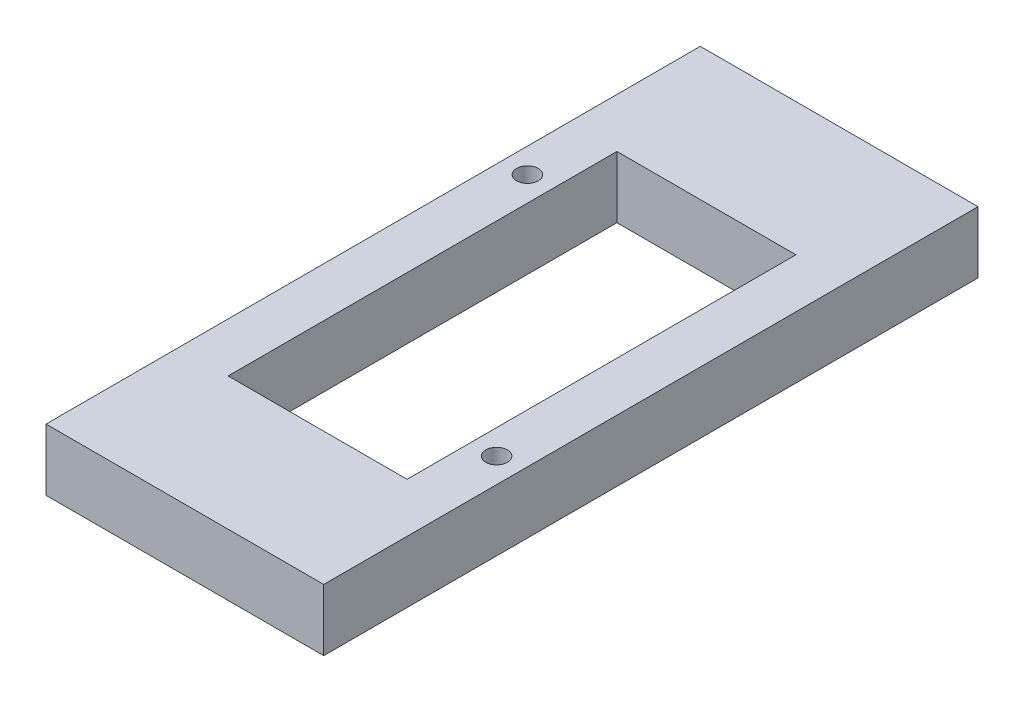
from build123d import *

# Parameters (mm, degrees)
SKETCH_1_W      = 45
SKETCH_1_H      = 106
SKETCH_1_R      = 1.75
SKETCH_1_W_2    = 29
SKETCH_1_H_2    = 63
EXTRUDE_1_DEPTH = 10


with BuildPart() as part:
    # 草图1 → 凸台-拉伸1 (new body)
    with BuildSketch(Plane(origin=(0, 0, 0), x_dir=(1, 0, 0), z_dir=(0, 1, 0))):
        with Locations((22.5, -53)):
            Rectangle(SKETCH_1_W, SKETCH_1_H)
        with Locations(Location((4, -32, 0), (0, 0, 270))):
            Circle(SKETCH_1_R, mode=Mode.SUBTRACT)
        with Locations(Location((41, -74, 0), (0, 0, 270))):
            Circle(SKETCH_1_R, mode=Mode.SUBTRACT)
        with Locations((22.5, -53)):
            Rectangle(SKETCH_1_W_2, SKETCH_1_H_2, mode=Mode.SUBTRACT)
    extrude(amount=EXTRUDE_1_DEPTH)


solid = part.part
